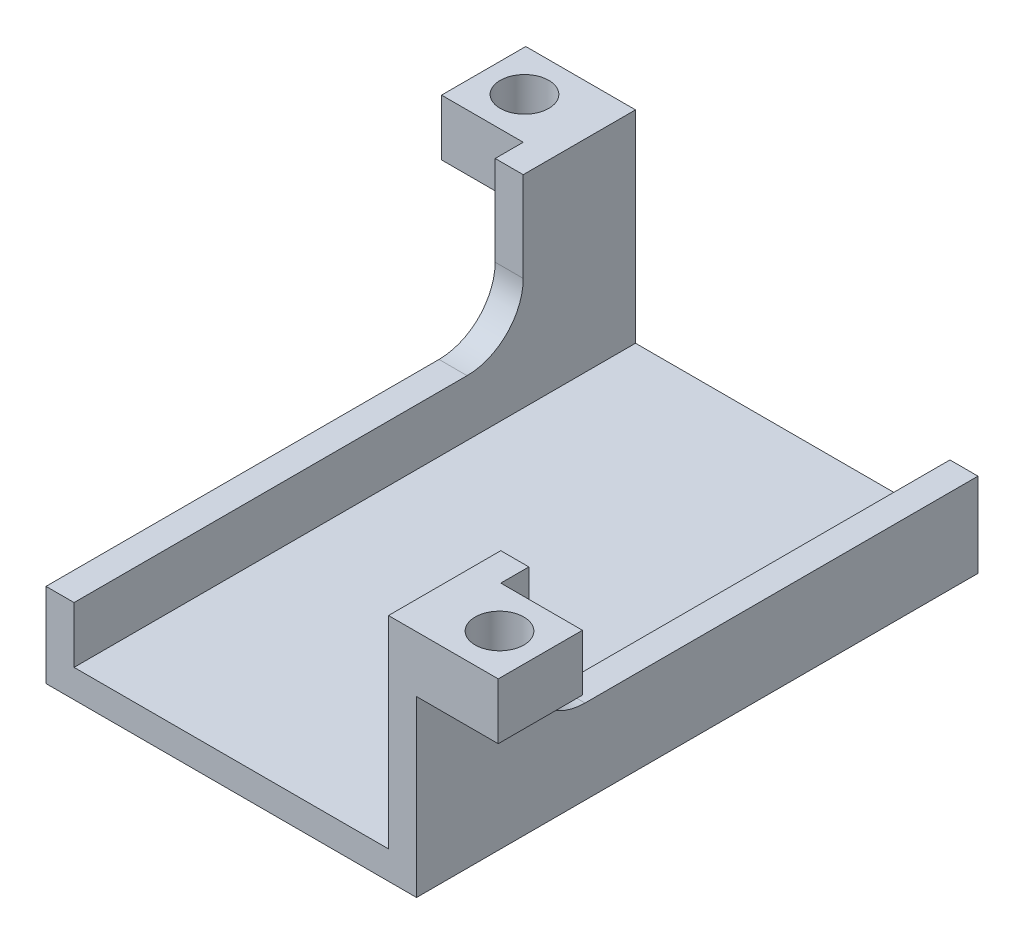
from build123d import *

# Parameters (mm, degrees)
SKETCH1_W           = 41.91
SKETCH1_H           = 63.5
BOSS_EXTRUDE1_DEPTH = 3.175
SKETCH2_W           = 3.175
SKETCH2_H           = 63.5
BOSS_EXTRUDE2_DEPTH = 6.35
SKETCH5_W           = 3.175
SKETCH5_H           = 12.7
BOSS_EXTRUDE4_DEPTH = 16.51
SKETCH6_W           = 9.237604307
SKETCH6_H           = 9.525
SKETCH6_R           = 2.75
BOSS_EXTRUDE5_DEPTH = 6.35
FILLET2_R           = 6.35


with BuildPart() as part:
    # Sketch1 → Boss-Extrude1 (new body)
    with BuildSketch(Plane(origin=(0, 0, 0), x_dir=(1, 0, 0), z_dir=(0, 1, 0))):
        Rectangle(SKETCH1_W, SKETCH1_H)
    extrude(amount=BOSS_EXTRUDE1_DEPTH)

    # Sketch2 → Boss-Extrude2 (add)
    with BuildSketch(Plane(origin=(0, 3.175, 0), x_dir=(1, 0, 0), z_dir=(0, 1, 0))):
        with Locations((-19.3675, 0)):
            Rectangle(SKETCH2_W, SKETCH2_H)
        with Locations((19.3675, 0)):
            Rectangle(SKETCH2_W, SKETCH2_H)
    extrude(amount=BOSS_EXTRUDE2_DEPTH)

    # Sketch5 → Boss-Extrude4 (add)
    with BuildSketch(Plane(origin=(0, 9.525, 0), x_dir=(1, 0, 0), z_dir=(0, 1, 0))):
        with Locations((19.3675, 25.4)):
            Rectangle(SKETCH5_W, SKETCH5_H)
        with Locations((-19.3675, -25.4)):
            Rectangle(SKETCH5_W, SKETCH5_H)
    extrude(amount=BOSS_EXTRUDE4_DEPTH)

    # Sketch6 → Boss-Extrude5 (add)
    # profile 1 of 2: a face of its own
    with BuildSketch(Plane(origin=(0, 26.035, 0), x_dir=(1, 0, 0), z_dir=(0, 1, 0))):
        with Locations((-25.573802154, -26.9875)):
            Rectangle(SKETCH6_W, SKETCH6_H)
        with Locations(Location((-25.573802154, -26.9875, 0), (0, 0, 270))):
            Circle(SKETCH6_R, mode=Mode.SUBTRACT)
    # profile 2 of 2: a face of its own
    with BuildSketch(Plane(origin=(0, 26.035, 0), x_dir=(1, 0, 0), z_dir=(0, 1, 0))):
        with Locations((25.573802154, 26.9875)):
            Rectangle(SKETCH6_W, SKETCH6_H)
        with Locations(Location((25.573802154, 26.9875, 0), (0, 0, 270))):
            Circle(SKETCH6_R, mode=Mode.SUBTRACT)
    extrude(amount=-BOSS_EXTRUDE5_DEPTH)

    # Fillet2
    fillet2_edges = [part.edges().sort_by_distance(p)[0] for p in [
        (19.3675, 9.525, -19.05),
        (-19.3675, 9.525, 19.05),
    ]]
    fillet(fillet2_edges, radius=FILLET2_R)


with BuildPart() as body_2:
    # Mirror1: mirrored copy
    add(part.part.mirror(Plane(origin=(-30.192604307, 19.685, 31.75), x_dir=(0, 0, 1), z_dir=(-1, 0, 0))))


solid = body_2.part
